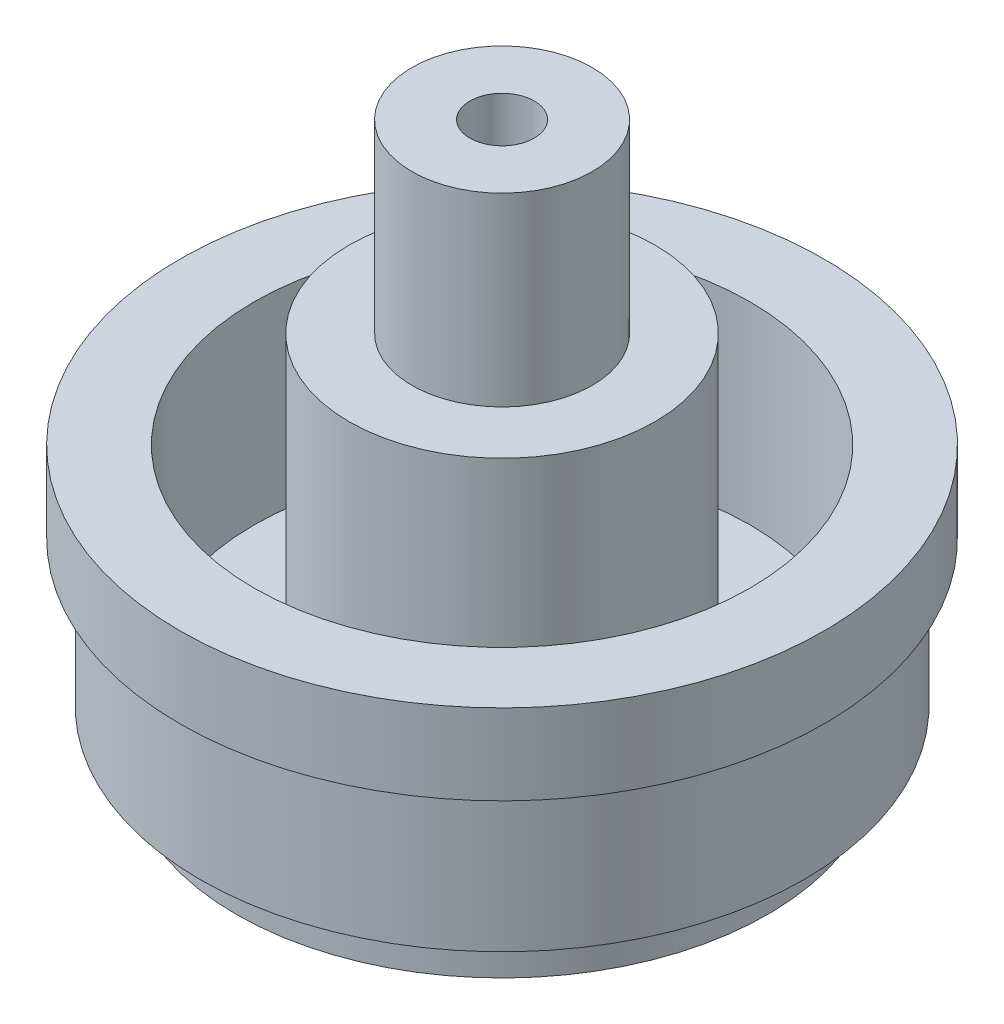
from build123d import *

# Parameters (mm, degrees)
SKETCH1_R                = 50.8
SKETCH1_R_2              = 39.116
BOSS_EXTRUDE1_DEPTH      = 12.7
BOSS_EXTRUDE2_DEPTH      = 20.32
BOSS_EXTRUDE2_DEPTH_BACK = 2.54
SKETCH2_R                = 47.625
SKETCH2_R_2              = 39.116
BOSS_EXTRUDE3_DEPTH      = 7.62
BOSS_EXTRUDE3_DEPTH_BACK = 5.08
SKETCH4_R                = 41.91
BOSS_EXTRUDE4_START      = -2.54
SKETCH5_R                = 24.13
BOSS_EXTRUDE4_DEPTH      = 45.72
BOSS_EXTRUDE5_START      = -2.54
SKETCH6_R                = 14.224
BOSS_EXTRUDE5_DEPTH      = 29.21
SKETCH7_R                = 16.51
CUT_EXTRUDE1_DEPTH       = 50.8
SKETCH8_R                = 5.08
CUT_EXTRUDE2_DEPTH       = 26.416


with BuildPart() as part:
    # Sketch1 → Boss-Extrude1 (new body)
    with BuildSketch(Plane(origin=(0, 0, 0), x_dir=(1, 0, 0), z_dir=(0, 1, 0))):
        with Locations(Location((0, 0, 0), (0, 0, 270))):
            Circle(SKETCH1_R)
        with Locations(Location((0, 0, 0), (0, 0, 270))):
            Circle(SKETCH1_R_2, mode=Mode.SUBTRACT)
    extrude(amount=-BOSS_EXTRUDE1_DEPTH)



with BuildPart() as body_2:
    # Sketch2 → Boss-Extrude2 (new, two sides: drawn at the far end of the back side and taken through both)
    with BuildSketch(Plane(origin=(0, -15.24, 0), x_dir=(-1, 0, 0), z_dir=(0, -1, 0)).offset(-BOSS_EXTRUDE2_DEPTH_BACK)):
        with Locations(Location((0, 0, 0), (0, 0, 270))):
            Circle(SKETCH2_R)
        with Locations(Location((0, 0, 0), (0, 0, 270))):
            Circle(SKETCH2_R_2, mode=Mode.SUBTRACT)
    extrude(amount=BOSS_EXTRUDE2_DEPTH + BOSS_EXTRUDE2_DEPTH_BACK)

    # Sketch4 → Boss-Extrude3 (add, two sides: drawn at the far end of the back side and taken through both)
    with BuildSketch(Plane(origin=(0, -38.1, 0), x_dir=(1, 0, 0), z_dir=(0, 1, 0)).offset(-BOSS_EXTRUDE3_DEPTH_BACK)):
        with Locations(Location((0, 0, 0), (0, 0, 270))):
            Circle(SKETCH4_R)
    extrude(amount=BOSS_EXTRUDE3_DEPTH + BOSS_EXTRUDE3_DEPTH_BACK)


with BuildPart() as part_1:
    add(part.part)

    add(body_2.part)  # Boss-Extrude4 merges body 2
    # Sketch5 → Boss-Extrude4 (add)
    with BuildSketch(Plane(origin=(0, -27.94, 0), x_dir=(1, 0, 0), z_dir=(0, 1, 0)).offset(BOSS_EXTRUDE4_START)):
        with Locations(Location((0, 0, 0), (0, 0, 270))):
            Circle(SKETCH5_R)
    extrude(amount=BOSS_EXTRUDE4_DEPTH)

    # Sketch6 → Boss-Extrude5 (add)
    with BuildSketch(Plane(origin=(0, 17.78, 0), x_dir=(1, 0, 0), z_dir=(0, 1, 0)).offset(BOSS_EXTRUDE5_START)):
        with Locations(Location((0, 0, 0), (0, 0, 90))):
            Circle(SKETCH6_R)
    extrude(amount=BOSS_EXTRUDE5_DEPTH)

    # Sketch7 → Cut-Extrude1 (cut)
    with BuildSketch(Plane(origin=(0, -45.72, 0), x_dir=(-1, 0, 0), z_dir=(0, -1, 0))):
        with Locations(Location((0, 0, 0), (0, 0, 90))):
            Circle(SKETCH7_R)
    extrude(amount=-CUT_EXTRUDE1_DEPTH, mode=Mode.SUBTRACT)

    # Sketch8 → Cut-Extrude2 (cut)
    with BuildSketch(Plane(origin=(0, 46.99, 0), x_dir=(1, 0, 0), z_dir=(0, 1, 0))):
        with Locations(Location((0, 0, 0), (0, 0, 270))):
            Circle(SKETCH8_R)
    extrude(amount=-CUT_EXTRUDE2_DEPTH, mode=Mode.SUBTRACT)


solid = part_1.part
